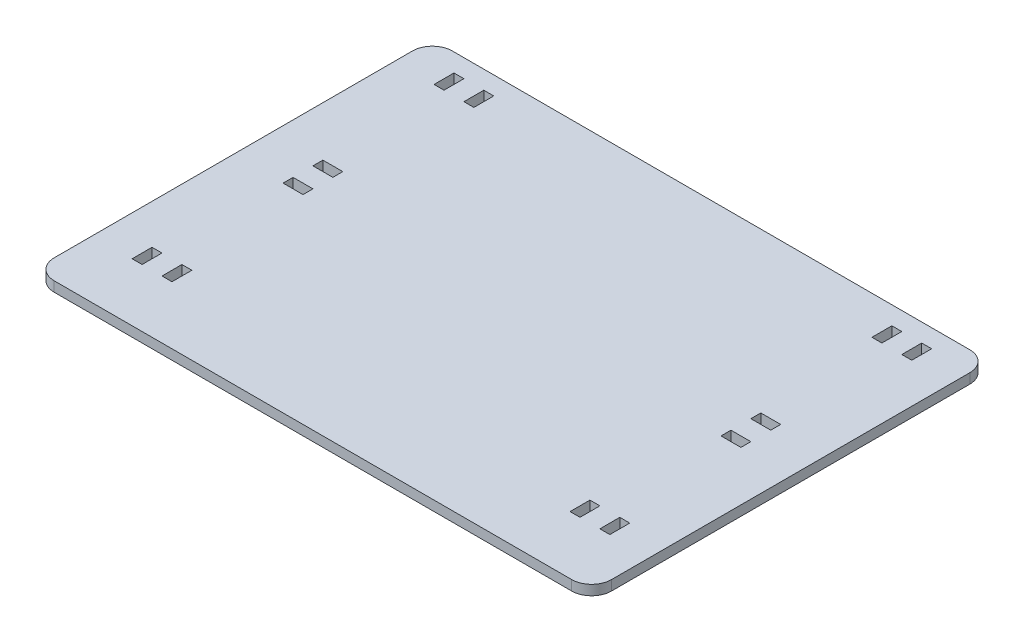
from build123d import *

# Parameters (mm, degrees)
ESQUISSE2_W                  = 355.6
ESQUISSE2_H                  = 254
BOSS_EXTRU_1_DEPTH           = 6.35
ENL_V_MAT_EXTRU_1_DEPTH      = 219.591313871
ENL_V_MAT_EXTRU_1_DEPTH_BACK = 219.591313871
ESQUISSE3_W                  = 12.7
ESQUISSE3_H                  = 6.35
ESQUISSE3_W_2                = 6.35
ESQUISSE3_H_2                = 12.7
CONG_1_R                     = 12.7


with BuildPart() as part:
    # Esquisse2 → Boss.-Extru.1 (new body)
    with BuildSketch(Plane(origin=(0, 0, 0), x_dir=(1, 0, 0), z_dir=(0, 1, 0))):
        Rectangle(ESQUISSE2_W, ESQUISSE2_H)
    extrude(amount=BOSS_EXTRU_1_DEPTH)

    # Esquisse3 → Enlèv. mat.-Extru.1 (cut, two sides: drawn at the far end of the back side and taken through both)
    with BuildSketch(Plane(origin=(0, 6.35, 0), x_dir=(1, 0, 0), z_dir=(0, 1, 0)).offset(-ENL_V_MAT_EXTRU_1_DEPTH_BACK)):
        with Locations((-139.7, 22.225)):
            Rectangle(ESQUISSE3_W, ESQUISSE3_H)
        with Locations((-139.7, 3.175)):
            Rectangle(ESQUISSE3_W, ESQUISSE3_H)
        with Locations((-130.175, -83.6168)):
            Rectangle(ESQUISSE3_W_2, ESQUISSE3_H_2)
        with Locations((-149.225, 109.0168)):
            Rectangle(ESQUISSE3_W_2, ESQUISSE3_H_2)
        with Locations((-130.175, 109.0168)):
            Rectangle(ESQUISSE3_W_2, ESQUISSE3_H_2)
        with Locations((-149.225, -83.6168)):
            Rectangle(ESQUISSE3_W_2, ESQUISSE3_H_2)
        with Locations((149.225, -83.6168)):
            Rectangle(ESQUISSE3_W_2, ESQUISSE3_H_2)
        with Locations((130.175, -83.6168)):
            Rectangle(ESQUISSE3_W_2, ESQUISSE3_H_2)
        with Locations((130.175, 109.0168)):
            Rectangle(ESQUISSE3_W_2, ESQUISSE3_H_2)
        with Locations((149.225, 109.0168)):
            Rectangle(ESQUISSE3_W_2, ESQUISSE3_H_2)
        with Locations((139.7, 3.175)):
            Rectangle(ESQUISSE3_W, ESQUISSE3_H)
        with Locations((139.7, 22.225)):
            Rectangle(ESQUISSE3_W, ESQUISSE3_H)
    extrude(amount=ENL_V_MAT_EXTRU_1_DEPTH + ENL_V_MAT_EXTRU_1_DEPTH_BACK, mode=Mode.SUBTRACT)

    # Congé1
    cong_1_edges = [part.edges().sort_by_distance(p)[0] for p in [
        (177.8, 3.175, 127),
        (-177.8, 3.175, 127),
        (-177.8, 3.175, -127),
        (177.8, 3.175, -127),
    ]]
    fillet(cong_1_edges, radius=CONG_1_R)


solid = part.part
